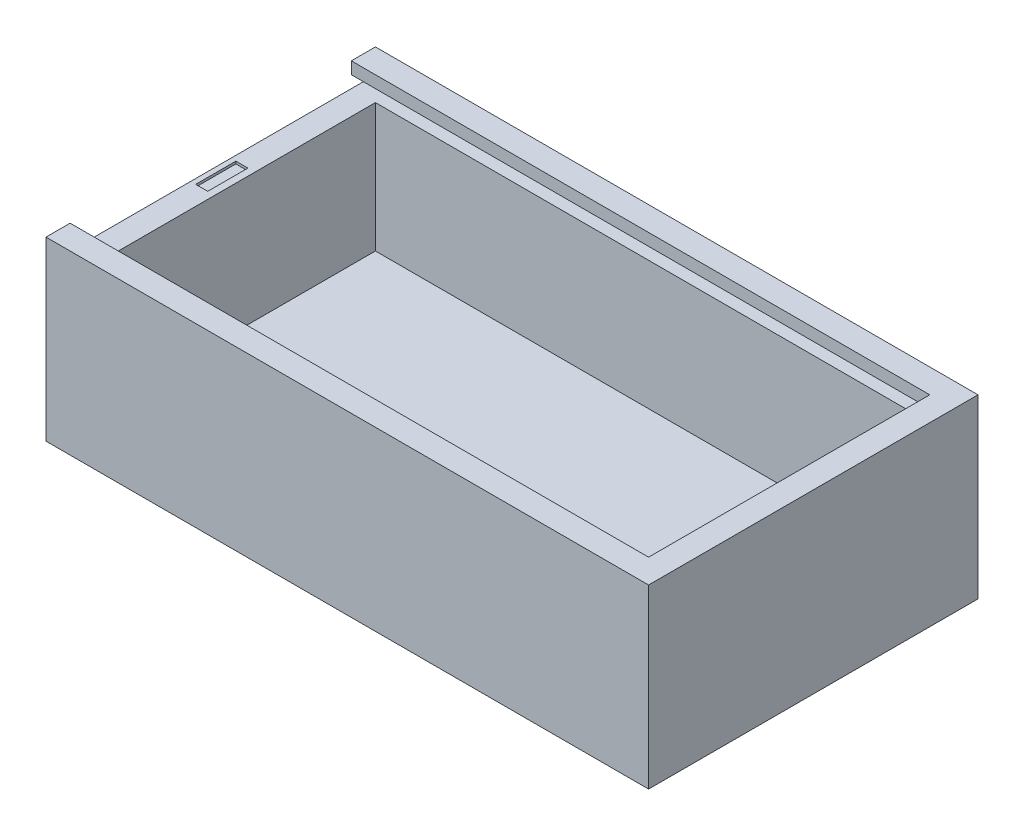
from build123d import *

# Parameters (mm, degrees)
CROQUIS1_W              = 75
CROQUIS1_H              = 41
CROQUIS1_W_2            = 69
CROQUIS1_H_2            = 35
SALIENTE_EXTRUIR1_DEPTH = 22
CROQUIS1_2_W            = 69
CROQUIS1_2_H            = 35
SALIENTE_EXTRUIR2_DEPTH = 3
CORTAR_EXTRUIR1_DEPTH   = 72
CROQUIS4_W              = 38
CROQUIS4_H              = 1.5
CORTAR_EXTRUIR2_DEPTH   = 1.5
CROQUIS7_W              = 1.5
CROQUIS7_H              = 5
CORTAR_EXTRUIR3_DEPTH   = 0.3


with BuildPart() as part:
    # Croquis1 → Saliente-Extruir1 (new body)
    with BuildSketch(Plane(origin=(0, 0, 0), x_dir=(1, 0, 0), z_dir=(0, 1, 0))):
        Rectangle(CROQUIS1_W, CROQUIS1_H)
        Rectangle(CROQUIS1_W_2, CROQUIS1_H_2, mode=Mode.SUBTRACT)
    extrude(amount=SALIENTE_EXTRUIR1_DEPTH)

    # Croquis1<2> → Saliente-Extruir2 (add)
    with BuildSketch(Plane(origin=(0, 0, 0), x_dir=(1, 0, 0), z_dir=(0, 1, 0))):
        Rectangle(CROQUIS1_2_W, CROQUIS1_2_H)
    extrude(amount=SALIENTE_EXTRUIR2_DEPTH)

    # Croquis3 → Cortar-Extruir1 (cut)
    with BuildSketch(Plane.ZY.offset(37.5)):
        Polygon((17.5, 22), (-17.5, 22), (-17.5, 20.5), (-19, 20.5), (-19, 19), (19, 19), (19, 20.5), (17.5, 20.5), align=None)
    extrude(amount=-CORTAR_EXTRUIR1_DEPTH, mode=Mode.SUBTRACT)

    # Croquis4 → Cortar-Extruir2 (cut)
    with BuildSketch(Plane.ZY.offset(-34.5)):
        with Locations((0, 19.75)):
            Rectangle(CROQUIS4_W, CROQUIS4_H)
    extrude(amount=-CORTAR_EXTRUIR2_DEPTH, mode=Mode.SUBTRACT)

    # Croquis7 → Cortar-Extruir3 (cut)
    with BuildSketch(Plane(origin=(0, 19, 0), x_dir=(1, 0, 0), z_dir=(0, 1, 0))):
        with Locations((-36.121212609, 0)):
            Rectangle(CROQUIS7_W, CROQUIS7_H)
    extrude(amount=-CORTAR_EXTRUIR3_DEPTH, mode=Mode.SUBTRACT)


solid = part.part
